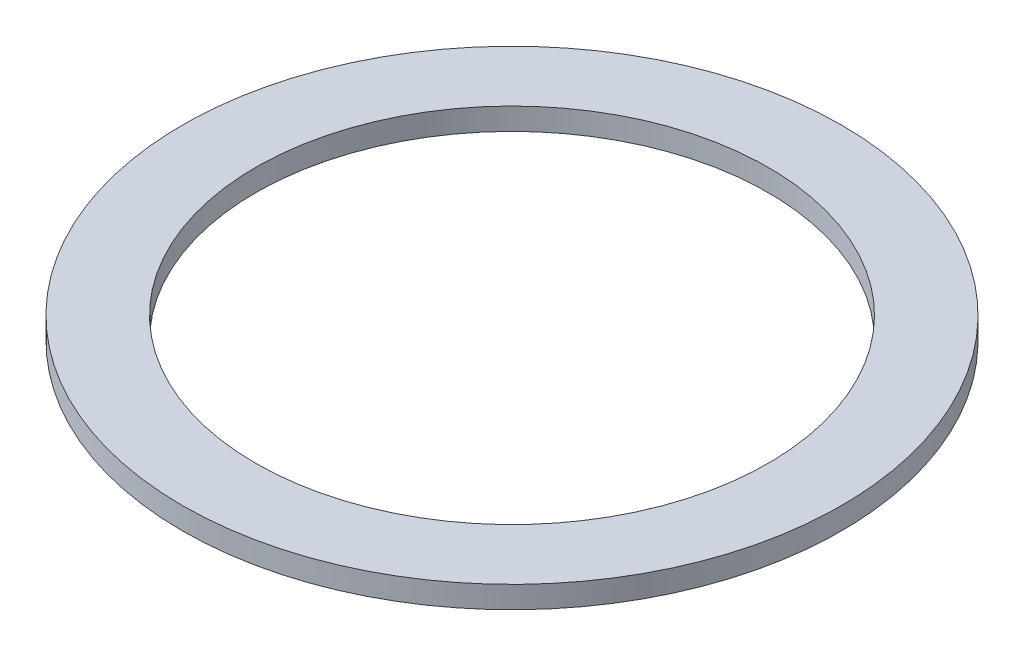
from build123d import *

# Parameters (mm, degrees)
CROQUIS1_R              = 45
CROQUIS1_R_2            = 35
SALIENTE_EXTRUIR1_DEPTH = 3


with BuildPart() as part:
    # Croquis1 → Saliente-Extruir1 (new body)
    with BuildSketch(Plane(origin=(0, 0, 0), x_dir=(1, 0, 0), z_dir=(0, 1, 0))):
        with Locations(Location((0, 0, 0), (0, 0, 270))):
            Circle(CROQUIS1_R)
        with Locations(Location((0, 0, 0), (0, 0, 270))):
            Circle(CROQUIS1_R_2, mode=Mode.SUBTRACT)
    extrude(amount=SALIENTE_EXTRUIR1_DEPTH)


solid = part.part
